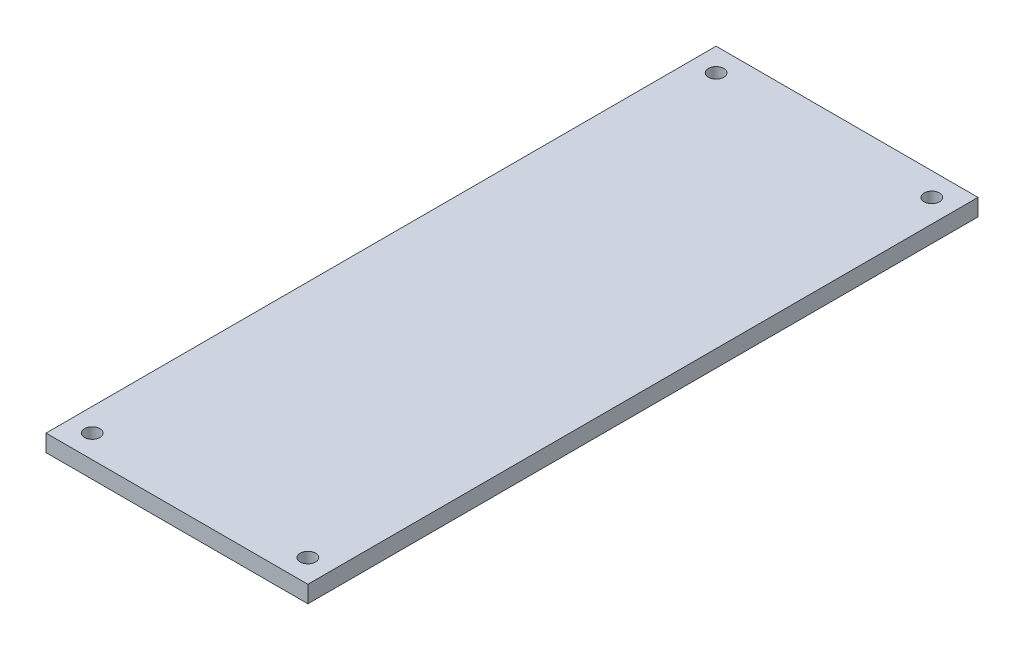
from build123d import *

# Parameters (mm, degrees)
SKETCH_1_W      = 34
SKETCH_1_H      = 87
SKETCH_1_R      = 1
EXTRUDE_1_DEPTH = 2.2


with BuildPart() as part:
    # 草图1 → 凸台-拉伸1 (new body)
    with BuildSketch(Plane(origin=(0, 0, 0), x_dir=(1, 0, 0), z_dir=(0, 1, 0))):
        with Locations((17, -43.5)):
            Rectangle(SKETCH_1_W, SKETCH_1_H)
        with Locations(Location((3, -3, 0), (0, 0, 270))):
            Circle(SKETCH_1_R, mode=Mode.SUBTRACT)
        with Locations(Location((31, -3, 0), (0, 0, 270))):
            Circle(SKETCH_1_R, mode=Mode.SUBTRACT)
        with Locations(Location((31, -84, 0), (0, 0, 270))):
            Circle(SKETCH_1_R, mode=Mode.SUBTRACT)
        with Locations(Location((3, -84, 0), (0, 0, 270))):
            Circle(SKETCH_1_R, mode=Mode.SUBTRACT)
    extrude(amount=EXTRUDE_1_DEPTH)


solid = part.part
